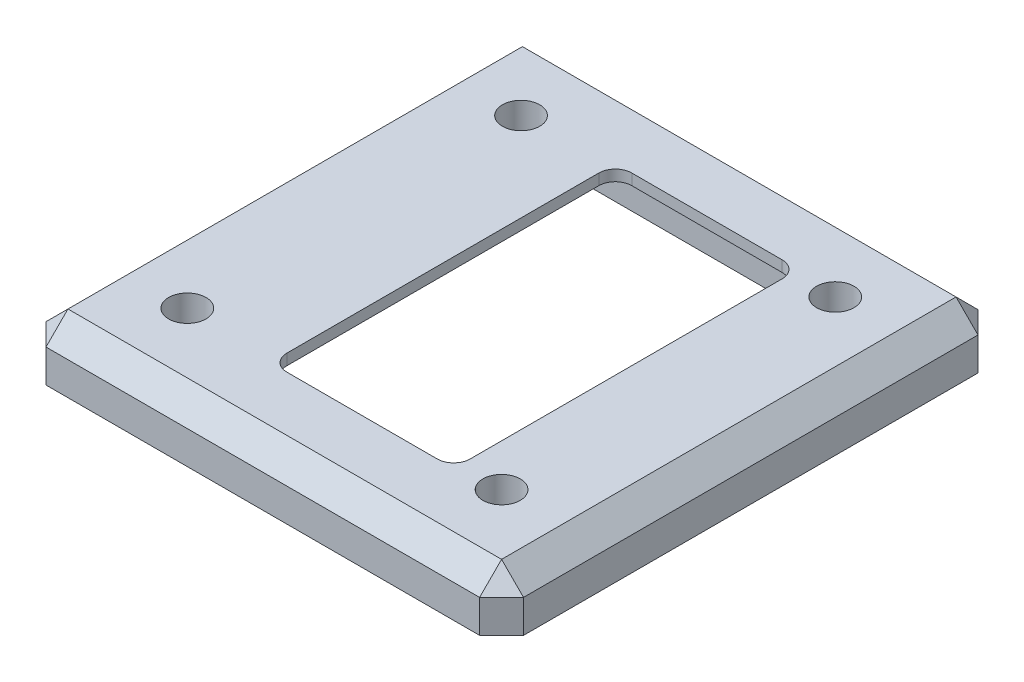
from build123d import *

# Parameters (mm, degrees)
EXTRUDE_2_DEPTH   = 5
EXTRUDE_3_DEPTH   = 3.8
EXTRUDE_4_DEPTH   = 1
CHAMFER_1_SIZE    = 2
HOLE_WIZARD_M31_D = 3.4


with BuildPart() as part:
    # Эскиз2 → Бобышка-Вытянуть2 (new body)
    with BuildSketch(Plane(origin=(0, 0, 0), x_dir=(1, 0, 0), z_dir=(0, 1, 0))):
        Polygon((-21.75, 7), (-21.75, -7), (-21.75, -11.7), (-21.75, -22.7), (21.75, -22.7), (21.75, 22.7), (-21.75, 22.7), (-21.75, 11.7), align=None)
        Polygon((-16.75, 17.7), (16.75, 17.7), (16.75, -17.7), (-16.75, -17.7), (-16.75, -11.7), (-16.75, -7), (-16.75, 7), (-16.75, 11.7), align=None, mode=Mode.SUBTRACT)
    extrude(amount=EXTRUDE_2_DEPTH)

    # Эскиз3 → Бобышка-Вытянуть3 (add)
    with BuildSketch(Plane(origin=(0, 5, 0), x_dir=(1, 0, 0), z_dir=(0, 1, 0))):
        with BuildLine():
            Line((-16.75, 17.7), (-16.75, 12.7))
            Line((-16.75, 12.7), (-15.75, 12.7))
            Line((-15.75, 12.7), (-13.001919935, 12.7))
            ThreePointArc((-13.001919935, 12.7), (-12.294813154, 12.992893219), (-12.001919935, 13.7))
            Line((-12.001919935, 13.7), (-12.001919935, 16.7))
            Line((-12.001919935, 16.7), (-12.001919935, 17.7))
            Line((-12.001919935, 17.7), (-16.75, 17.7))
        make_face()
        with BuildLine():
            Line((15.75, 12.7), (16.75, 12.7))
            Line((16.75, 12.7), (16.75, 17.7))
            Line((16.75, 17.7), (11.75, 17.7))
            Line((11.75, 17.7), (11.75, 16.7))
            Line((11.75, 16.7), (11.75, 13.7))
            ThreePointArc((11.75, 13.7), (12.042893219, 12.992893219), (12.75, 12.7))
            Line((12.75, 12.7), (15.75, 12.7))
        make_face()
        with BuildLine():
            Line((11.75, -16.7), (11.75, -17.7))
            Line((11.75, -17.7), (16.75, -17.7))
            Line((16.75, -17.7), (16.75, -12.7))
            Line((16.75, -12.7), (15.75, -12.7))
            Line((15.75, -12.7), (12.75, -12.7))
            ThreePointArc((12.75, -12.7), (12.042893219, -12.992893219), (11.75, -13.7))
            Line((11.75, -13.7), (11.75, -16.7))
        make_face()
        with BuildLine():
            Line((-12.001919935, -16.7), (-12.001919935, -13.7))
            ThreePointArc((-12.001919935, -13.7), (-12.294813154, -12.992893219), (-13.001919935, -12.7))
            Line((-13.001919935, -12.7), (-15.75, -12.7))
            Line((-15.75, -12.7), (-16.75, -12.7))
            Line((-16.75, -12.7), (-16.75, -17.7))
            Line((-16.75, -17.7), (-12.001919935, -17.7))
            Line((-12.001919935, -17.7), (-12.001919935, -16.7))
        make_face()
    extrude(amount=-EXTRUDE_3_DEPTH)

    # Эскиз4 → Бобышка-Вытянуть4 (add)
    with BuildSketch(Plane(origin=(0, 5, 0), x_dir=(1, 0, 0), z_dir=(0, 1, 0))):
        with BuildLine():
            Line((-16.75, -12.7), (-13.001919935, -12.7))
            ThreePointArc((-13.001919935, -12.7), (-12.294813154, -12.992893219), (-12.001919935, -13.7))
            Line((-12.001919935, -13.7), (-12.001919935, -17.7))
            Line((-12.001919935, -17.7), (11.75, -17.7))
            Line((11.75, -17.7), (11.75, -13.7))
            ThreePointArc((11.75, -13.7), (12.042893219, -12.992893219), (12.75, -12.7))
            Line((12.75, -12.7), (16.75, -12.7))
            Line((16.75, -12.7), (16.75, 12.7))
            Line((16.75, 12.7), (12.75, 12.7))
            ThreePointArc((12.75, 12.7), (12.042893219, 12.992893219), (11.75, 13.7))
            Line((11.75, 13.7), (11.75, 17.7))
            Line((11.75, 17.7), (-12.001919935, 17.7))
            Line((-12.001919935, 17.7), (-12.001919935, 13.7))
            ThreePointArc((-12.001919935, 13.7), (-12.294813154, 12.992893219), (-13.001919935, 12.7))
            Line((-13.001919935, 12.7), (-16.75, 12.7))
            Line((-16.75, 12.7), (-16.75, -12.7))
        make_face()
        with BuildLine():
            Line((-4.8, -15.71), (8.9, -15.71))
            ThreePointArc((8.9, -15.71), (9.960660172, -15.270660172), (10.4, -14.21))
            Line((10.4, -14.21), (10.4, 14.21))
            ThreePointArc((10.4, 14.21), (9.960660172, 15.270660172), (8.9, 15.71))
            Line((8.9, 15.71), (-4.8, 15.71))
            ThreePointArc((-4.8, 15.71), (-5.860660172, 15.270660172), (-6.3, 14.21))
            Line((-6.3, 14.21), (-6.3, -14.21))
            ThreePointArc((-6.3, -14.21), (-5.860660172, -15.270660172), (-4.8, -15.71))
        make_face(mode=Mode.SUBTRACT)
    extrude(amount=-EXTRUDE_4_DEPTH)

    # Фаска1
    chamfer_1_edges = [part.edges().sort_by_distance(p)[0] for p in [
        (-21.75, 2.5, -22.7),
        (21.75, 2.5, -22.7),
        (21.75, 2.5, 22.7),
        (-21.75, 2.5, 22.7),
        (-21.75, 5, 0),
        (0, 5, 22.7),
        (21.75, 5, 0),
        (0, 5, -22.7),
    ]]
    chamfer(chamfer_1_edges, length=CHAMFER_1_SIZE)

    # Отверстие с зазором M31 (through all)
    with Locations(Plane(origin=(0, 5, 0), x_dir=(1, 0, 0), z_dir=(0, 1, 0))):
        with Locations((14.25, -15.2), (14.25, 15.2), (-14.375959967, 15.2), (-14.375959967, -15.2)):
            Hole(HOLE_WIZARD_M31_D / 2)


solid = part.part
